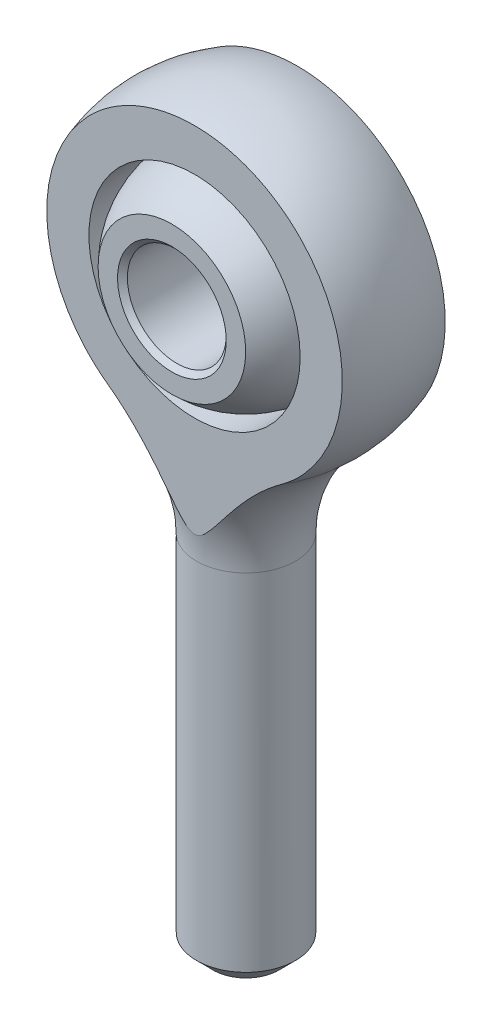
from build123d import *

# Parameters (mm, degrees)
SKETCH1_W               = 3
SKETCH1_H               = 22
CHAMFER2_SIZE           = 1
CUT_EXTRUDE1_DEPTH      = 28.069355367
CUT_EXTRUDE1_DEPTH_BACK = 28.069355367
CUT_EXTRUDE2_DEPTH      = 26.539491491
CUT_EXTRUDE2_DEPTH_BACK = 26.539491491
SKETCH6_R               = 6.4135
CUT_EXTRUDE3_DEPTH      = 27.130872546
CUT_EXTRUDE3_DEPTH_BACK = 27.130872546
SKETCH8_W               = 5
SKETCH8_H               = 23.5
CUT_EXTRUDE4_DEPTH      = 27.130872546
CUT_EXTRUDE4_DEPTH_BACK = 27.130872546
SKETCH10_R              = 3
CHAMFER1_SIZE           = 0.3


with BuildPart() as part:
    # Sketch1 → Revolve1 (revolve)
    with BuildSketch(Plane.XY):
        with Locations((1.5, -11)):
            Rectangle(SKETCH1_W, SKETCH1_H)
    revolve(axis=Axis((0, 23.5, 0), (0, -1, 0)))

    # Chamfer2
    chamfer2_edges = [part.edges().sort_by_distance(p)[0] for p in [
        (-3, -22, 0),
    ]]
    chamfer(chamfer2_edges, length=CHAMFER2_SIZE)

    # Sketch4 → Revolve2 (revolve)
    with BuildSketch(Plane.XY):
        with BuildLine():
            Line((3, 0), (0, 0))
            Line((0, 0), (0, 23.5))
            ThreePointArc((0, 23.5), (8.921667095, 17.264024547), (6.130640084, 6.742917104))
            ThreePointArc((6.130640084, 6.742917104), (3.820824689, 3.717117109), (3, 0))
        make_face()
    revolve(axis=Axis((0, 23.5, 0), (0, 1, 0)))

    # Sketch5 → Cut-Extrude1 (cut, two sides: drawn at the far end of the back side and taken through both)
    with BuildSketch(Plane(origin=(0, 0, 0), x_dir=(0, 0, -1), z_dir=(1, 0, 0)).offset(-CUT_EXTRUDE1_DEPTH_BACK)):
        Polygon((3.125, 23.5), (9.5, 23.5), (9.5, 0), (3, 0), (3.125, 1.25), align=None)
        Polygon((-3.125, 23.5), (-3.125, 1.25), (-3, 0), (-9.5, 0), (-9.5, 23.5), align=None)
    extrude(amount=CUT_EXTRUDE1_DEPTH + CUT_EXTRUDE1_DEPTH_BACK, mode=Mode.SUBTRACT)

    # Sketch6 → Cut-Extrude2 (cut, two sides: drawn at the far end of the back side and taken through both)
    with BuildSketch(Plane.XY.offset(-CUT_EXTRUDE2_DEPTH_BACK)):
        with Locations((0, 14)):
            Circle(SKETCH6_R)
    extrude(amount=CUT_EXTRUDE2_DEPTH + CUT_EXTRUDE2_DEPTH_BACK, mode=Mode.SUBTRACT)


with BuildPart() as body_2:
    # Sketch7 → Revolve3 (revolve)
    with BuildSketch(Plane.XY):
        with BuildLine():
            Line((0, 20.35), (0, 7.65))
            ThreePointArc((0, 7.65), (6.35, 14), (0, 20.35))
        make_face()
    revolve(axis=Axis((0, 0, 0), (0, 1, 0)))

    # Sketch8 → Cut-Extrude3 (cut, two sides: drawn at the far end of the back side and taken through both)
    with BuildSketch(Plane(origin=(0, 0, 0), x_dir=(0, 0, -1), z_dir=(1, 0, 0)).offset(-CUT_EXTRUDE3_DEPTH_BACK)):
        with Locations((-7, 11.75)):
            Rectangle(SKETCH8_W, SKETCH8_H)
        with Locations((7, 11.75)):
            Rectangle(SKETCH8_W, SKETCH8_H)
    extrude(amount=CUT_EXTRUDE3_DEPTH + CUT_EXTRUDE3_DEPTH_BACK, mode=Mode.SUBTRACT)

    # Sketch10 → Cut-Extrude4 (cut, two sides: drawn at the far end of the back side and taken through both)
    with BuildSketch(Plane.XY.offset(-CUT_EXTRUDE4_DEPTH_BACK)):
        with Locations((0, 14)):
            Circle(SKETCH10_R)
    extrude(amount=CUT_EXTRUDE4_DEPTH + CUT_EXTRUDE4_DEPTH_BACK, mode=Mode.SUBTRACT)

    # Chamfer1
    chamfer1_edges = [body_2.edges().sort_by_distance(p)[0] for p in [
        (-3, 14, -4.5),
        (-3, 14, 4.5),
    ]]
    chamfer(chamfer1_edges, length=CHAMFER1_SIZE)


solid = Compound([part.part, body_2.part])
